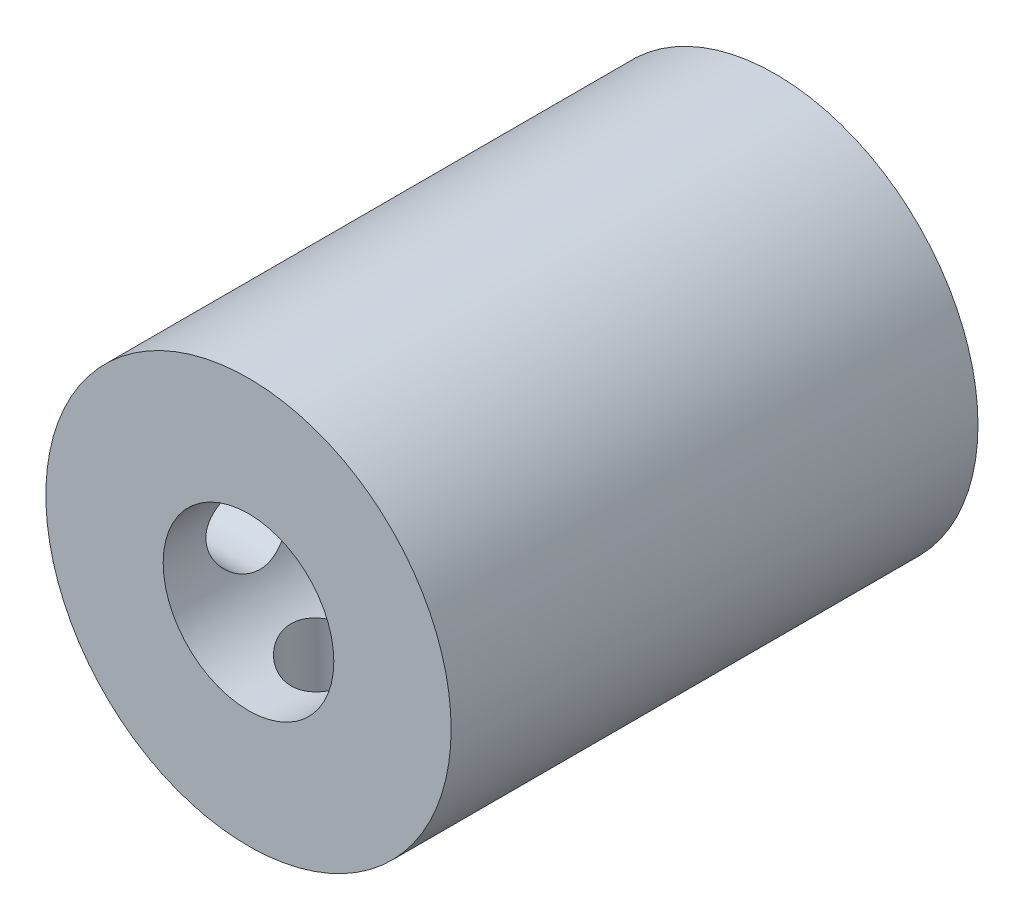
from build123d import *

# Parameters (mm, degrees)
ESQUISSE1_R                  = 9.5
BOSS_EXTRU_1_DEPTH           = 24.7
ESQUISSE2_R                  = 4
ENL_V_MAT_EXTRU_1_DEPTH      = 18
ESQUISSE3_R                  = 2.5
ENL_V_MAT_EXTRU_2_DEPTH      = 29.117432315
ESQUISSE4_R                  = 2
ENL_V_MAT_EXTRU_3_DEPTH      = 29.117432315
R_P_TITION_CIRCULAIRE1_COUNT = 2
R_P_TITION_CIRCULAIRE1_ANGLE = 90


with BuildPart() as part:
    # Esquisse1 → Boss.-Extru.1 (new body)
    with BuildSketch(Plane.XY):
        Circle(ESQUISSE1_R)
    extrude(amount=BOSS_EXTRU_1_DEPTH)

    # Esquisse2 → Enlèv. mat.-Extru.1 (cut)
    with BuildSketch(Plane.XY.offset(24.7)):
        Circle(ESQUISSE2_R)
    extrude(amount=-ENL_V_MAT_EXTRU_1_DEPTH, mode=Mode.SUBTRACT)

    # Esquisse3 → Enlèv. mat.-Extru.2 (cut, through all)
    with BuildSketch(Plane(origin=(0, 0, 0), x_dir=(-1, 0, 0), z_dir=(0, 0, -1))):
        Circle(ESQUISSE3_R)
    extrude(amount=-ENL_V_MAT_EXTRU_2_DEPTH, mode=Mode.SUBTRACT)

    # Esquisse4 → Enlèv. mat.-Extru.3 (cut, through all)
    with BuildSketch(Plane(origin=(0, 0, 0), x_dir=(1, 0, 0), z_dir=(0, 1, 0))):
        with Locations(Location((0, -4, 0), (0, 0, 270))):
            Circle(ESQUISSE4_R)
        with Locations(Location((0, -20.7, 0), (0, 0, 270))):
            Circle(ESQUISSE4_R)
    enl_v_mat_extru_3 = extrude(amount=-ENL_V_MAT_EXTRU_3_DEPTH, mode=Mode.SUBTRACT)

    # Répétition circulaire1: Enlèv. mat.-Extru.3 ×2 about axis
    r_p_tition_circulaire1_axis = Axis((0, 0, 6.7), (0, 0, -1))
    for i in range(1, R_P_TITION_CIRCULAIRE1_COUNT):
        add(enl_v_mat_extru_3.rotate(r_p_tition_circulaire1_axis, i * R_P_TITION_CIRCULAIRE1_ANGLE / (R_P_TITION_CIRCULAIRE1_COUNT - 1)), mode=Mode.SUBTRACT)


solid = part.part
